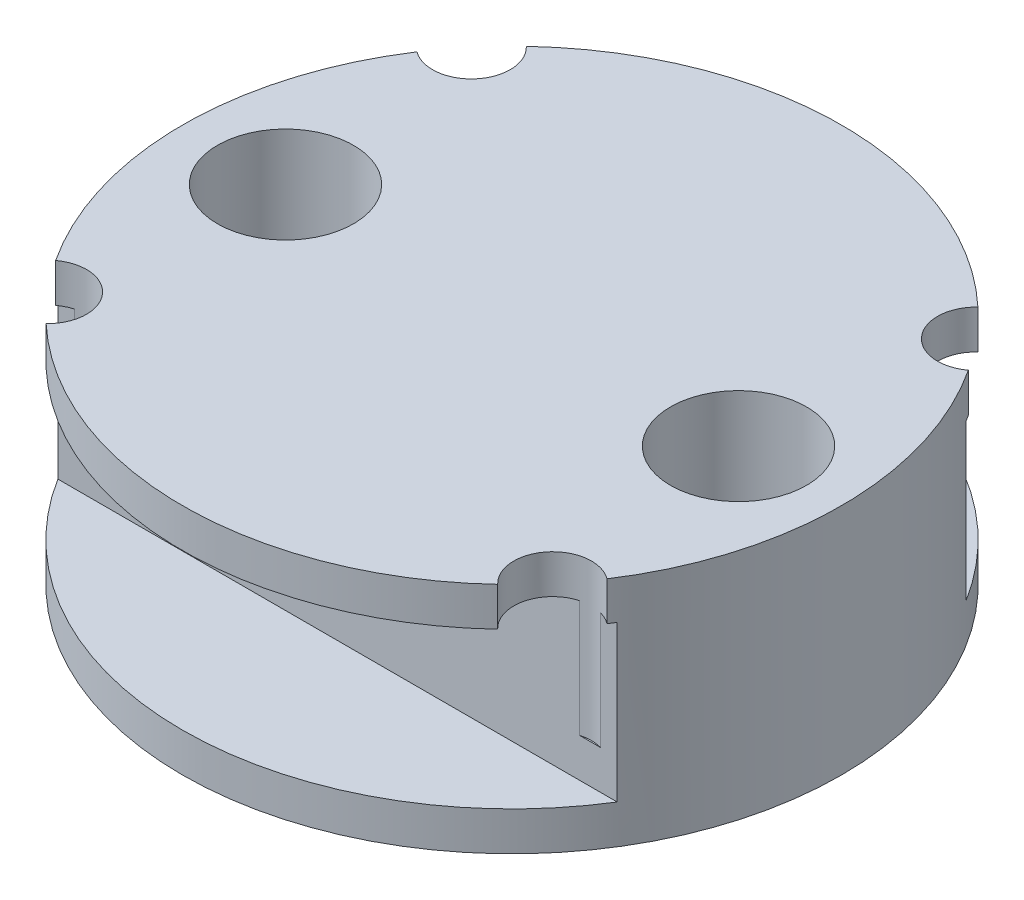
from build123d import *

# Parameters (mm, degrees)
SKETCH1_R                               = 8.477787946
BOSS_EXTRUDE1_DEPTH                     = 6
SKETCH2_R                               = 1.75
CUT_EXTRUDE1_DEPTH                      = 3
CBORE_FOR_M5_HEX_HEAD_BOLT1_D           = 1.5
CBORE_FOR_M5_HEX_HEAD_BOLT1_CBORE_D     = 4
CBORE_FOR_M5_HEX_HEAD_BOLT1_CBORE_DEPTH = 1
CUT_EXTRUDE6_START                      = -1.48
SKETCH10_W                              = 21.455120181
SKETCH10_H                              = 4
CUT_EXTRUDE6_DEPTH                      = 4
SKETCH12_W                              = 22.336955322
SKETCH12_H                              = 4
CUT_EXTRUDE7_DEPTH                      = 4
SKETCH13_R                              = 1
CUT_EXTRUDE8_DEPTH                      = 4


with BuildPart() as part:
    # Sketch1 → Boss-Extrude1 (new body)
    with BuildSketch(Plane(origin=(0, 0, 0), x_dir=(1, 0, 0), z_dir=(0, 1, 0))):
        with Locations(Location((-4.607856835, 9.967667798, 0), (0, 0, 270))):
            Circle(SKETCH1_R)
    extrude(amount=-BOSS_EXTRUDE1_DEPTH)

    # Sketch2 → Cut-Extrude1 (cut)
    with BuildSketch(Plane(origin=(0, 0, 0), x_dir=(1, 0, 0), z_dir=(0, 1, 0))):
        with Locations(Location((-10.434250808, 9.967667798, 0), (0, 0, 270))):
            Circle(SKETCH2_R)
        with Locations(Location((1.218537138, 9.967667798, 0), (0, 0, 270))):
            Circle(SKETCH2_R)
    extrude(amount=-CUT_EXTRUDE1_DEPTH, mode=Mode.SUBTRACT)

    # CBORE for M5 Hex Head Bolt1 (through all)
    with Locations(Plane(origin=(0, -6, 0), x_dir=(-1, 0, 0), z_dir=(0, -1, 0))):
        with Locations((10.434250808, 9.967667798), (-1.218537138, 9.967667798)):
            CounterBoreHole(CBORE_FOR_M5_HEX_HEAD_BOLT1_D / 2, CBORE_FOR_M5_HEX_HEAD_BOLT1_CBORE_D / 2, CBORE_FOR_M5_HEX_HEAD_BOLT1_CBORE_DEPTH)

    # Sketch10 → Cut-Extrude6 (cut)
    with BuildSketch(Plane.XY.offset(CUT_EXTRUDE6_START)):
        with Locations((-4.34718715, -3)):
            Rectangle(SKETCH10_W, SKETCH10_H)
    extrude(amount=-CUT_EXTRUDE6_DEPTH, mode=Mode.SUBTRACT)

    # Sketch12 → Cut-Extrude7 (cut)
    with BuildSketch(Plane(origin=(0, 0, -18.445455745), x_dir=(-1, 0, 0), z_dir=(0, 0, -1))):
        with Locations((4.129052905, -3)):
            Rectangle(SKETCH12_W, SKETCH12_H)
    extrude(amount=-CUT_EXTRUDE7_DEPTH, mode=Mode.SUBTRACT)

    # Sketch13 → Cut-Extrude8 (cut)
    with BuildSketch(Plane(origin=(0, 0, 0), x_dir=(1, 0, 0), z_dir=(0, 1, 0))):
        with Locations((1.886505511, 4.518250749)):
            Circle(SKETCH13_R)
        with Locations((-11.102219182, 4.518250749)):
            Circle(SKETCH13_R)
        with Locations((-11.102219182, 15.417084848)):
            Circle(SKETCH13_R)
        with Locations((1.886505511, 15.417084848)):
            Circle(SKETCH13_R)
    extrude(amount=-CUT_EXTRUDE8_DEPTH, mode=Mode.SUBTRACT)


solid = part.part
